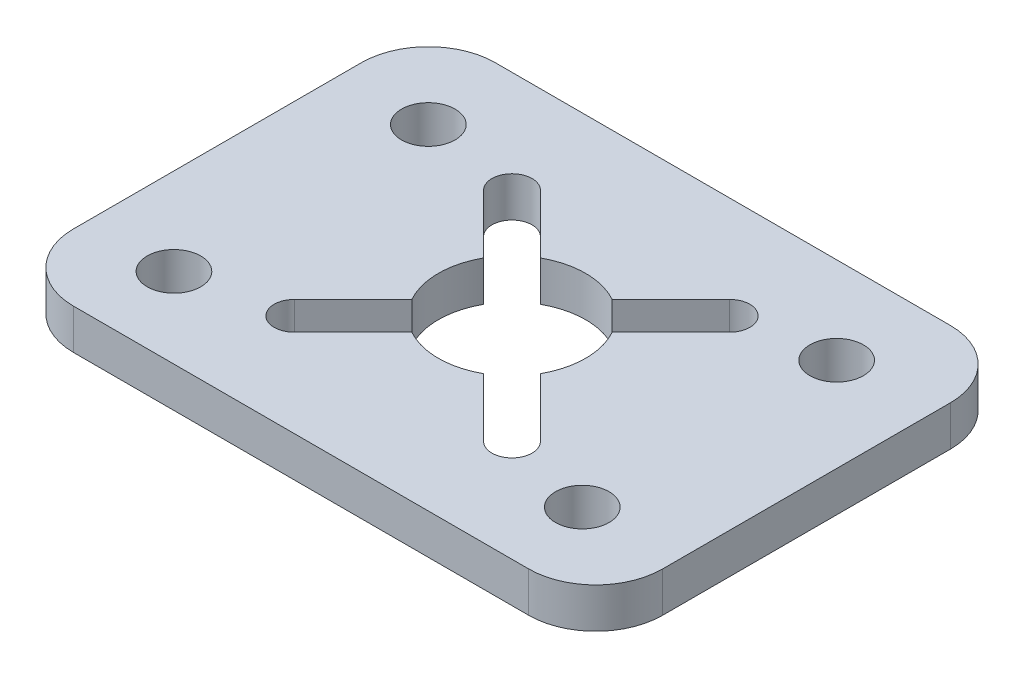
from build123d import *

# Parameters (mm, degrees)
SKETCH1_W            = 44
SKETCH1_H            = 31.5
BOSS_EXTRUDE1_DEPTH  = 3
SKETCH2_R            = 5.5
CUT_EXTRUDE1_DEPTH   = 3
CUT_EXTRUDE2_DEPTH   = 3
CUT_EXTRUDE3_DEPTH   = 3
SKETCH5_R            = 2
CUT_EXTRUDE4_DEPTH   = 3
LPATTERN1_COUNT      = 2
LPATTERN1_PITCH      = 30.5
LPATTERN1_COUNT_DIR2 = 2
LPATTERN1_PITCH_DIR2 = 19
FILLET1_R            = 5


with BuildPart() as part:
    # Sketch1 → Boss-Extrude1 (new body)
    with BuildSketch(Plane(origin=(0, 0, 0), x_dir=(1, 0, 0), z_dir=(0, 1, 0))):
        with Locations((22, 15.75)):
            Rectangle(SKETCH1_W, SKETCH1_H)
    extrude(amount=BOSS_EXTRUDE1_DEPTH)

    # Sketch2 → Cut-Extrude1 (cut)
    with BuildSketch(Plane(origin=(0, 3, 0), x_dir=(1, 0, 0), z_dir=(0, 1, 0))):
        with Locations(Location((22, 15.75, 0), (0, 0, 270))):
            Circle(SKETCH2_R)
    extrude(amount=-CUT_EXTRUDE1_DEPTH, mode=Mode.SUBTRACT)

    # Sketch3 → Cut-Extrude2 (cut)
    with BuildSketch(Plane(origin=(0, 3, 0), x_dir=(1, 0, 0), z_dir=(0, 1, 0))):
        with BuildLine():
            Line((14.928932188, 24.942388155), (31.192388155, 8.678932188))
            ThreePointArc((31.192388155, 8.678932188), (31.192388155, 6.557611845), (29.071067812, 6.557611845))
            Line((29.071067812, 6.557611845), (12.807611845, 22.821067812))
            ThreePointArc((12.807611845, 22.821067812), (12.807611845, 24.942388155), (14.928932188, 24.942388155))
        make_face()
    extrude(amount=-CUT_EXTRUDE2_DEPTH, mode=Mode.SUBTRACT)

    # Sketch4 → Cut-Extrude3 (cut)
    with BuildSketch(Plane(origin=(0, 3, 0), x_dir=(1, 0, 0), z_dir=(0, 1, 0))):
        with BuildLine():
            Line((31.192388155, 22.821067812), (14.928932188, 6.557611845))
            ThreePointArc((14.928932188, 6.557611845), (12.807611845, 6.557611845), (12.807611845, 8.678932188))
            Line((12.807611845, 8.678932188), (29.071067812, 24.942388155))
            ThreePointArc((29.071067812, 24.942388155), (31.192388155, 24.942388155), (31.192388155, 22.821067812))
        make_face()
    extrude(amount=-CUT_EXTRUDE3_DEPTH, mode=Mode.SUBTRACT)

    # Sketch5 → Cut-Extrude4 (cut)
    with BuildSketch(Plane(origin=(0, 3, 0), x_dir=(1, 0, 0), z_dir=(0, 1, 0))):
        with Locations(Location((6.5, 25, 0), (0, 0, 270))):
            Circle(SKETCH5_R)
    cut_extrude4 = extrude(amount=-CUT_EXTRUDE4_DEPTH, mode=Mode.SUBTRACT)

    # LPattern1: Cut-Extrude4 2 × 2
    with Locations(*[(i * LPATTERN1_PITCH, 0, j * LPATTERN1_PITCH_DIR2) for i in range(LPATTERN1_COUNT) for j in range(LPATTERN1_COUNT_DIR2) if (i, j) != (0, 0)]):
        add(cut_extrude4, mode=Mode.SUBTRACT)

    # Fillet1
    fillet1_edges = [part.edges().sort_by_distance(p)[0] for p in [
        (0, 1.5, -31.5),
        (44, 1.5, -31.5),
        (44, 1.5, 0),
        (0, 1.5, 0),
    ]]
    fillet(fillet1_edges, radius=FILLET1_R)


solid = part.part
